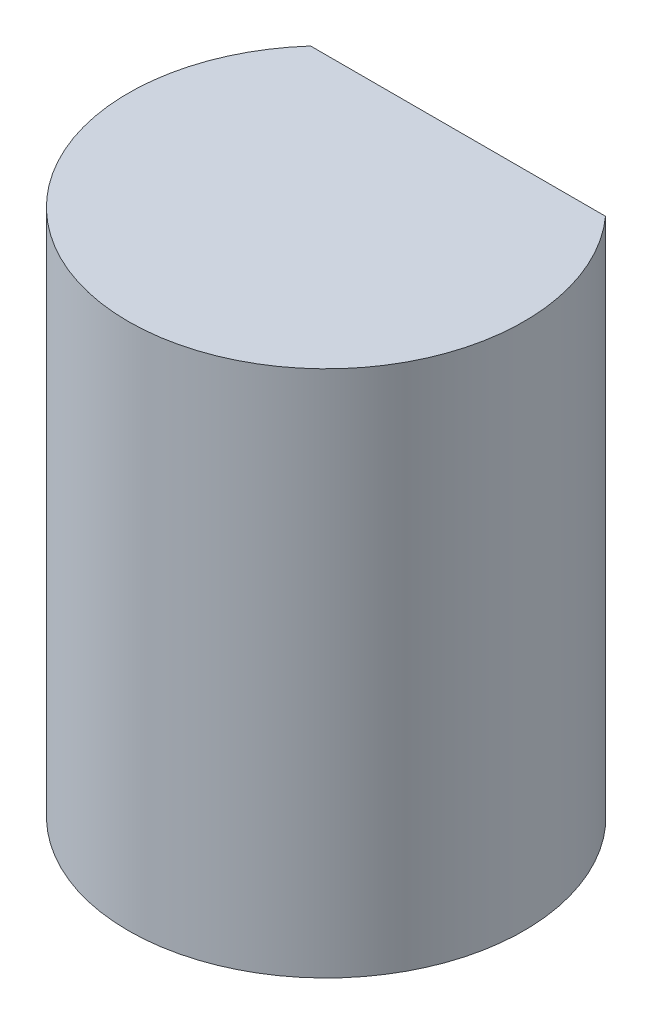
from build123d import *

# Parameters (mm, degrees)
SKETCH1_R           = 1.5
BOSS_EXTRUDE1_DEPTH = 4
CUT_EXTRUDE1_REACH  = 6.528
SKETCH6_W           = 2.236067978
SKETCH6_H           = 0.5


with BuildPart() as part:
    # Sketch1 → Boss-Extrude1 (new body)
    with BuildSketch(Plane(origin=(0, 0, 0), x_dir=(1, 0, 0), z_dir=(0, 1, 0))):
        with Locations(Location((0, 0, 0), (0, 0, 270))):
            Circle(SKETCH1_R)
    extrude(amount=BOSS_EXTRUDE1_DEPTH)

    # Sketch6 → Cut-Extrude1 (cut, up to next)
    with BuildSketch(Plane(origin=(0, 4, 0), x_dir=(1, 0, 0), z_dir=(0, 1, 0)), mode=Mode.PRIVATE) as cut_extrude1_sk1:
        with Locations((0, 1.25)):
            Rectangle(SKETCH6_W, SKETCH6_H)
    cut_extrude1_tool1 = extrude(cut_extrude1_sk1.sketch, amount=-CUT_EXTRUDE1_REACH, mode=Mode.PRIVATE) & part.part
    add(cut_extrude1_tool1.solids().sort_by_distance((0, 4, -1.25))[0], mode=Mode.SUBTRACT)


solid = part.part
